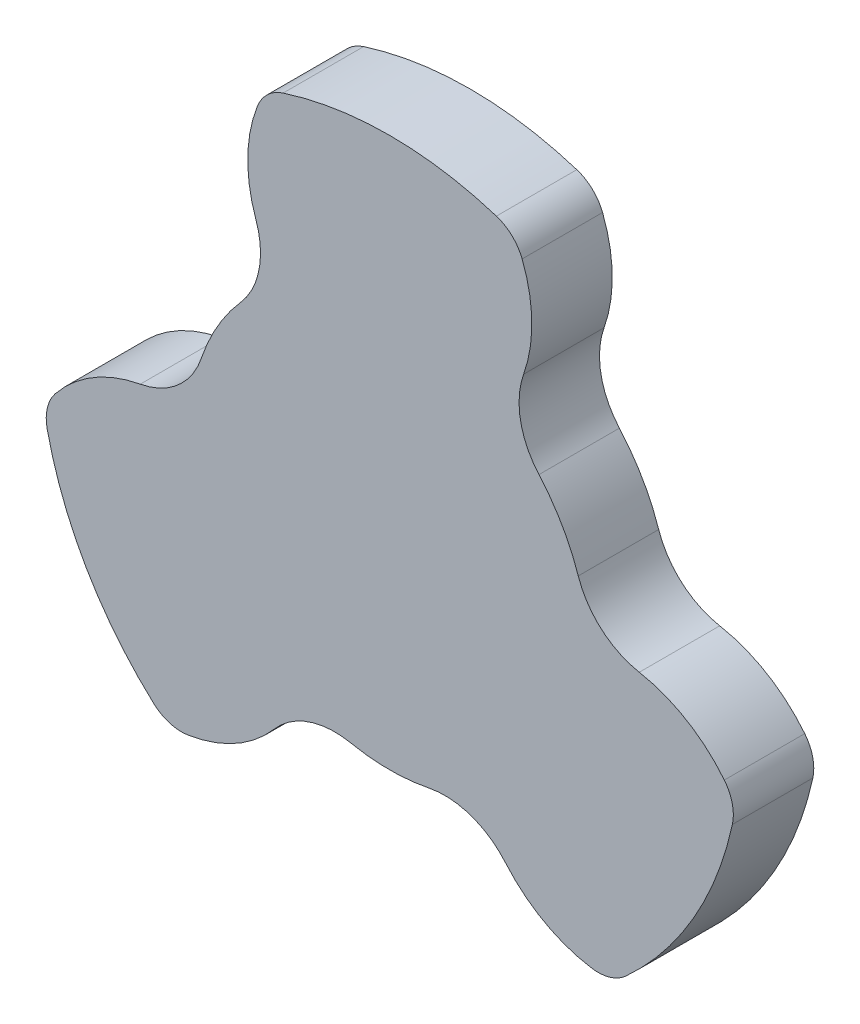
from build123d import *

# Parameters (mm, degrees)
BOSS_EXTRUDE1_DEPTH = 6.35


with BuildPart() as part:
    # Sketch1 → Boss-Extrude1 (new body)
    with BuildSketch(Plane.XY):
        with BuildLine():
            ThreePointArc((19.09558361, -27.286492755), (15.377016657, -28.688589019), (12.38097626, -31.299595732))
            ThreePointArc((12.38097626, -31.299595732), (11.754813891, -32.585358585), (11.743487691, -34.015441499))
            ThreePointArc((11.743487691, -34.015441499), (14.816954296, -41.959391499), (20.1598835, -48.593066656))
            ThreePointArc((20.1598835, -48.593066656), (21.404034733, -49.298299337), (22.830619211, -49.398908245))
            ThreePointArc((22.830619211, -49.398908245), (26.589837552, -48.109764507), (29.663372012, -45.590439192))
            ThreePointArc((29.663372012, -45.590439192), (32.39282557, -43.727845578), (35.689842925, -43.506829177))
            ThreePointArc((35.689842925, -43.506829177), (38.793733625, -43.816700713), (41.897624325, -43.506829177))
            ThreePointArc((41.897624325, -43.506829177), (45.194641681, -43.727845578), (47.924095238, -45.590439192))
            ThreePointArc((47.924095238, -45.590439192), (50.997629698, -48.109764507), (54.75684804, -49.398908245))
            ThreePointArc((54.75684804, -49.398908245), (56.183432518, -49.298299337), (57.427583751, -48.593066656))
            ThreePointArc((57.427583751, -48.593066656), (62.770512955, -41.959391499), (65.84397956, -34.015441499))
            ThreePointArc((65.84397956, -34.015441499), (65.83265336, -32.585358585), (65.206490991, -31.299595732))
            ThreePointArc((65.206490991, -31.299595732), (62.210450594, -28.688589019), (58.491883641, -27.286492755))
            ThreePointArc((58.491883641, -27.286492755), (55.514103476, -25.854013443), (53.67418898, -23.109220856))
            ThreePointArc((53.67418898, -23.109220856), (52.390600252, -20.266236892), (50.57029828, -17.733124463))
            ThreePointArc((50.57029828, -17.733124463), (49.11319542, -14.767315476), (49.361522028, -11.47224255))
            ThreePointArc((49.361522028, -11.47224255), (50.006554521, -7.550820971), (49.243376577, -3.650670519))
            ThreePointArc((49.243376577, -3.650670519), (48.442954467, -2.465516575), (47.210129434, -1.740666341))
            ThreePointArc((47.210129434, -1.740666341), (38.793733625, -0.430391499), (30.377337817, -1.740666341))
            ThreePointArc((30.377337817, -1.740666341), (29.144512783, -2.465516575), (28.344090674, -3.650670519))
            ThreePointArc((28.344090674, -3.650670519), (27.58091273, -7.550820971), (28.225945223, -11.47224255))
            ThreePointArc((28.225945223, -11.47224255), (28.47427183, -14.767315476), (27.01716897, -17.733124463))
            ThreePointArc((27.01716897, -17.733124463), (25.196866999, -20.266236892), (23.91327827, -23.109220856))
            ThreePointArc((23.91327827, -23.109220856), (22.073363775, -25.854013443), (19.09558361, -27.286492755))
        make_face()
    extrude(amount=BOSS_EXTRUDE1_DEPTH)


solid = part.part
